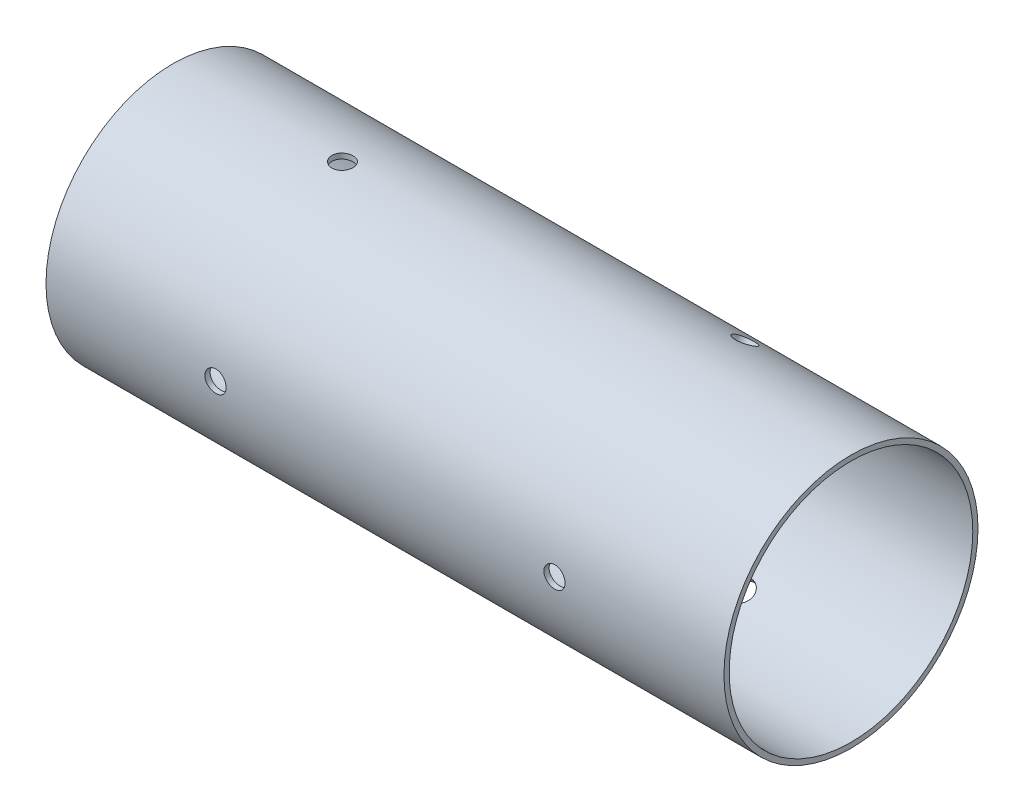
from build123d import *

# Parameters (mm, degrees)
SKETCH1_R           = 38.0746
SKETCH1_R_2         = 36.5125
BOSS_EXTRUDE1_DEPTH = 203.2
SKETCH2_R           = 3.175
CUT_EXTRUDE1_DEPTH  = 211.213202084
CIRPATTERN1_COUNT   = 4
SKETCH3_R           = 3.175
CUT_EXTRUDE2_DEPTH  = 297.323244266
CIRPATTERN2_COUNT   = 3


with BuildPart() as part:
    # Sketch1 → Boss-Extrude1 (new body)
    with BuildSketch(Plane.YZ):
        with Locations(Location((0, 0, 0), (0, 0, 270))):
            Circle(SKETCH1_R)
        with Locations(Location((0, 0, 0), (0, 0, 270))):
            Circle(SKETCH1_R_2, mode=Mode.SUBTRACT)
    extrude(amount=BOSS_EXTRUDE1_DEPTH)

    # Sketch2 → Cut-Extrude1 (cut, through all)
    with BuildSketch(Plane(origin=(0, 0, 0), x_dir=(-1, 0, 0), z_dir=(0, 1, 0))):
        with Locations(Location((-50.8, 0, 0), (0, 0, 270))):
            Circle(SKETCH2_R)
    cut_extrude1 = extrude(amount=CUT_EXTRUDE1_DEPTH, mode=Mode.SUBTRACT)

    # CirPattern1: Cut-Extrude1 ×4 about axis
    cirpattern1_axis = Axis((203.2, 0, 0), (-1, 0, 0))
    for i in range(1, CIRPATTERN1_COUNT):
        add(cut_extrude1.rotate(cirpattern1_axis, i * 360 / CIRPATTERN1_COUNT), mode=Mode.SUBTRACT)

    # Sketch3 → Cut-Extrude2 (cut, through all)
    with BuildSketch(Plane(origin=(0, 174.216591142, 0), x_dir=(-1, 0, 0), z_dir=(0, 0, 1))):
        with Locations((-152.4, 174.216591142)):
            Circle(SKETCH3_R)
    cut_extrude2 = extrude(amount=CUT_EXTRUDE2_DEPTH, mode=Mode.SUBTRACT)

    # CirPattern2: Cut-Extrude2 ×3 about axis
    cirpattern2_axis = Axis((203.2, 0, 0), (-1, 0, 0))
    for i in range(1, CIRPATTERN2_COUNT):
        add(cut_extrude2.rotate(cirpattern2_axis, i * 360 / CIRPATTERN2_COUNT), mode=Mode.SUBTRACT)


solid = part.part
